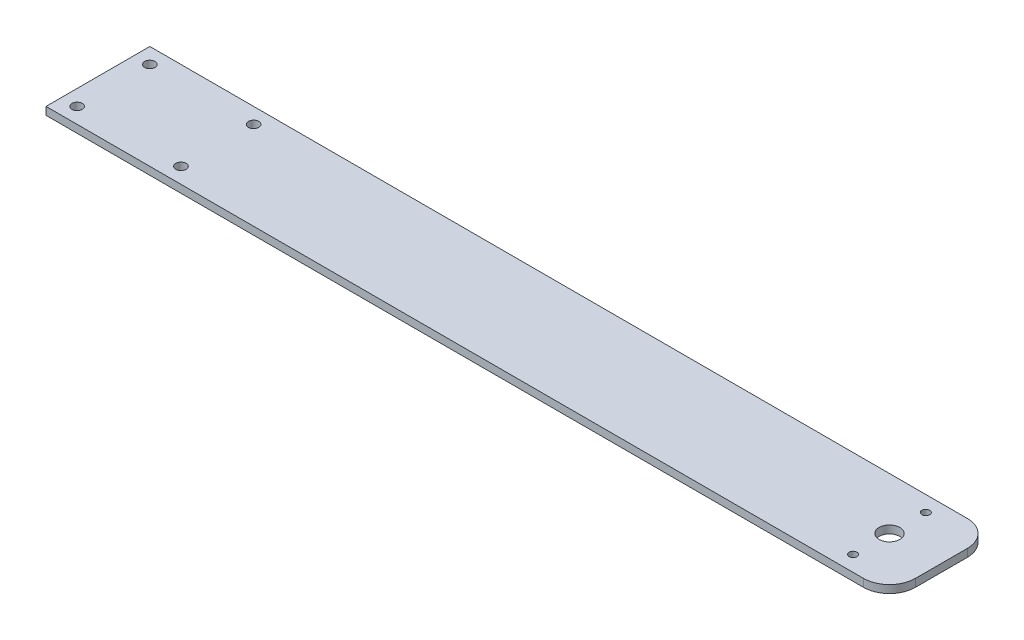
from build123d import *

# Parameters (mm, degrees)
SKETCH1_W           = 325
SKETCH1_H           = 40
SKETCH1_R           = 2
SKETCH1_R_2         = 4
SKETCH1_R_3         = 1.5
BOSS_EXTRUDE1_DEPTH = 3
FILLET1_R           = 10


with BuildPart() as part:
    # Sketch1 → Boss-Extrude1 (new body)
    with BuildSketch(Plane(origin=(0, 0, 0), x_dir=(1, 0, 0), z_dir=(0, 1, 0))):
        Rectangle(SKETCH1_W, SKETCH1_H)
        with Locations(Location((-156.5, 14, 0), (0, 0, 270))):
            Circle(SKETCH1_R, mode=Mode.SUBTRACT)
        with Locations(Location((-116.5, 14, 0), (0, 0, 270))):
            Circle(SKETCH1_R, mode=Mode.SUBTRACT)
        with Locations(Location((-116.5, -14, 0), (0, 0, 270))):
            Circle(SKETCH1_R, mode=Mode.SUBTRACT)
        with Locations(Location((-156.5, -14, 0), (0, 0, 270))):
            Circle(SKETCH1_R, mode=Mode.SUBTRACT)
        with Locations(Location((142.5, 0, 0), (0, 0, 270))):
            Circle(SKETCH1_R_2, mode=Mode.SUBTRACT)
        with Locations(Location((142.5, 14, 0), (0, 0, 270))):
            Circle(SKETCH1_R_3, mode=Mode.SUBTRACT)
        with Locations(Location((142.5, -14, 0), (0, 0, 270))):
            Circle(SKETCH1_R_3, mode=Mode.SUBTRACT)
    extrude(amount=BOSS_EXTRUDE1_DEPTH)

    # Fillet1
    fillet1_edges = [part.edges().sort_by_distance(p)[0] for p in [
        (162.5, 1.5, 20),
        (162.5, 1.5, -20),
    ]]
    fillet(fillet1_edges, radius=FILLET1_R)


solid = part.part
